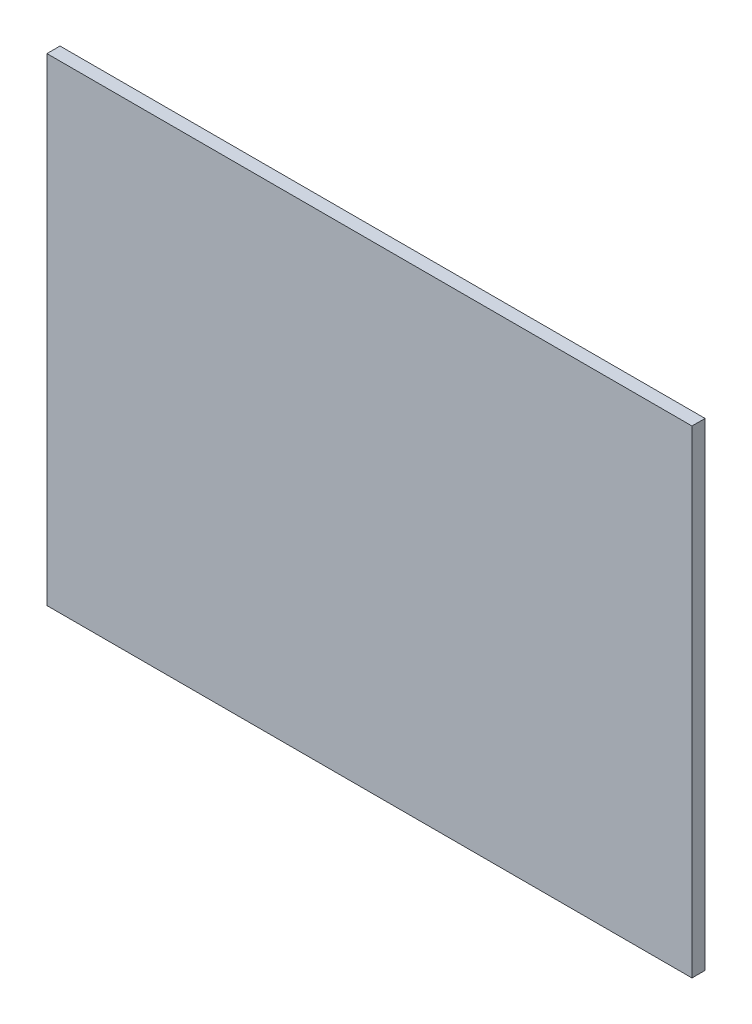
from build123d import *

# Parameters (mm, degrees)
SKETCH1_W           = 98.5
SKETCH1_H           = 73
BOSS_EXTRUDE1_DEPTH = 2


with BuildPart() as part:
    # Sketch1 → Boss-Extrude1 (new body)
    with BuildSketch(Plane.XY):
        Rectangle(SKETCH1_W, SKETCH1_H)
    extrude(amount=BOSS_EXTRUDE1_DEPTH)


solid = part.part
